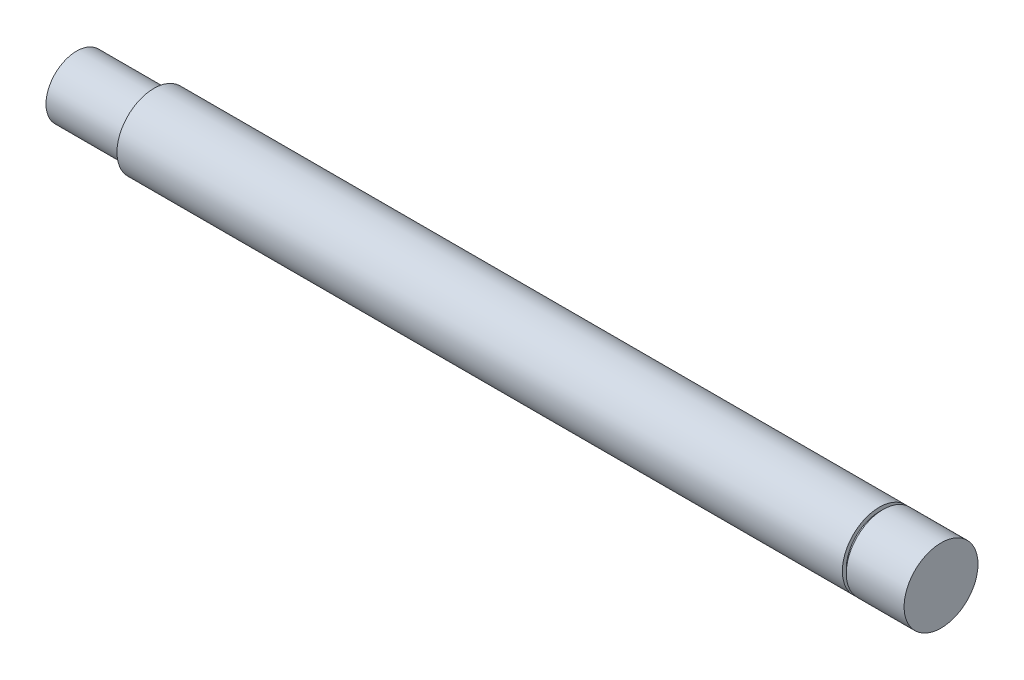
from build123d import *

# Parameters (mm, degrees)
SKETCH1_R          = 7.6
BASE_EXTRUDE_DEPTH = 177.8
CUT_EXTRUDE1_START = -0.8
SKETCH2_R          = 7.6
SKETCH2_R_2        = 6.8
CUT_EXTRUDE1_DEPTH = 0.8
SKETCH3_R          = 7.6
SKETCH3_R_2        = 6.3
CUT_EXTRUDE2_DEPTH = 15.9


with BuildPart() as part:
    # Sketch1 → Base-Extrude (new body)
    with BuildSketch(Plane(origin=(0, 0, 0), x_dir=(0, 0, -1), z_dir=(1, 0, 0))):
        Circle(SKETCH1_R)
    extrude(amount=BASE_EXTRUDE_DEPTH)

    # Sketch2 → Cut-Extrude1 (cut)
    with BuildSketch(Plane(origin=(165.9, 0, 0), x_dir=(0, 0, -1), z_dir=(1, 0, 0)).offset(CUT_EXTRUDE1_START)):
        Circle(SKETCH2_R)
        Circle(SKETCH2_R_2, mode=Mode.SUBTRACT)
    extrude(amount=CUT_EXTRUDE1_DEPTH, mode=Mode.SUBTRACT)

    # Sketch3 → Cut-Extrude2 (cut)
    with BuildSketch(Plane.ZY):
        Circle(SKETCH3_R)
        Circle(SKETCH3_R_2, mode=Mode.SUBTRACT)
    extrude(amount=-CUT_EXTRUDE2_DEPTH, mode=Mode.SUBTRACT)


solid = part.part
